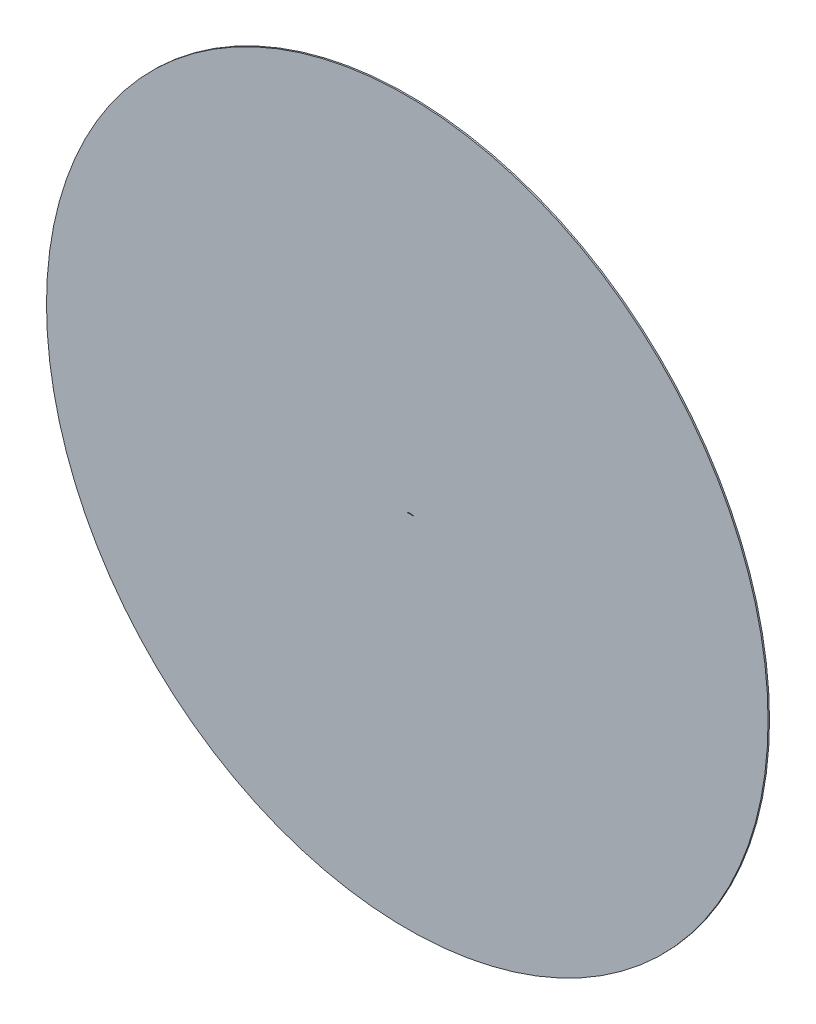
from build123d import *

# Parameters (mm, degrees)
SKETCH2_R           = 15000
BOSS_EXTRUDE1_DEPTH = 30


with BuildPart() as part:
    # Sketch2 → Boss-Extrude1 (new, symmetric)
    with BuildSketch(Plane.XY):
        Circle(SKETCH2_R)
        with BuildLine():
            add(Edge.make_bspline(
                [(300, 0), (300.000402811, 0.017891231), (297.85685975, 0.292445736), (295.723511165, 0.726892039), (290.679302282, 1.679480421), (284.635959687, 2.897374281), (276.879879046, 4.344515476), (267.820428048, 5.95277122), (257.455385673, 7.742244197), (245.967842139, 9.70661813), (233.506042756, 11.791266408), (220.251698882, 13.973921388), (206.381961989, 16.181684189), (192.087853074, 18.368463114), (177.558664746, 20.456607221), (162.970058246, 22.359948855), (148.455715134, 23.924482354), (134.124604138, 25.069711051), (120.062244475, 25.734136055), (106.348271385, 25.897975781), (93.055711097, 25.55539157), (80.265928232, 24.72930552), (68.072226575, 23.517124644), (56.587196337, 21.962426856), (45.925991759, 20.117779579), (36.195954376, 18.018495626), (27.487662894, 15.719457974), (19.885589191, 13.261539895), (13.445254022, 10.699603889), (8.244070372, 8.098339765), (4.221065897, 5.540205784), (1.631332116, 3.090369578), (-0.175553183, 0.951021204), (0.243621624, -1.564342184), (2.944995842, -2.756524441), (6.537285269, -3.980198081), (11.870367086, -4.891793693), (18.619142896, -5.620289145), (26.872186679, -6.09035157), (36.521534762, -6.338814104), (47.501784126, -6.356784583), (59.703243562, -6.193456753), (73.004439219, -5.869580451), (87.261097422, -5.419765172), (102.313620517, -4.878716358), (117.987122284, -4.282217579), (134.096773033, -3.664032423), (150.446415181, -3.048051097), (166.833269883, -2.463748796), (183.05225229, -1.928225129), (198.901180904, -1.450476519), (214.181407658, -1.047995638), (228.699242301, -0.713948731), (242.271153812, -0.457646545), (254.717826147, -0.266896562), (265.891722207, -0.145076144), (275.61251285, -0.058972976), (283.894928489, 0.015621095), (290.305617376, 0.116640601), (295.596309521, 0.08996108), (297.811219758, 0.119349423), (299.999594287, -0.018020093), (300, 0)],
                knots=[0, 0, 0, 0, 0.001687292, 0.006615882, 0.014465558, 0.024924198, 0.037799709, 0.05298847, 0.070316804, 0.089535109, 0.110360248, 0.132501123, 0.155650769, 0.179484174, 0.203672902, 0.227895237, 0.251892314, 0.275516865, 0.298645284, 0.321169245, 0.343005232, 0.364074693, 0.384236026, 0.403304982, 0.421105995, 0.437475165, 0.452282795, 0.46541465, 0.476784493, 0.486339784, 0.494068893, 0.499998921, 0.504170472, 0.506997163, 0.511089715, 0.517452454, 0.526208561, 0.537391702, 0.550962223, 0.566841318, 0.58490964, 0.604997386, 0.626900912, 0.650394481, 0.675201622, 0.701035252, 0.727593371, 0.754549691, 0.781563239, 0.808298626, 0.834420906, 0.859605071, 0.883531629, 0.90589572, 0.926412445, 0.944811581, 0.960857577, 0.974373753, 0.985246767, 0.993303881, 0.998300555, 1, 1, 1, 1], degree=3))
        make_face(mode=Mode.SUBTRACT)
    extrude(amount=BOSS_EXTRUDE1_DEPTH, both=True)


solid = part.part
